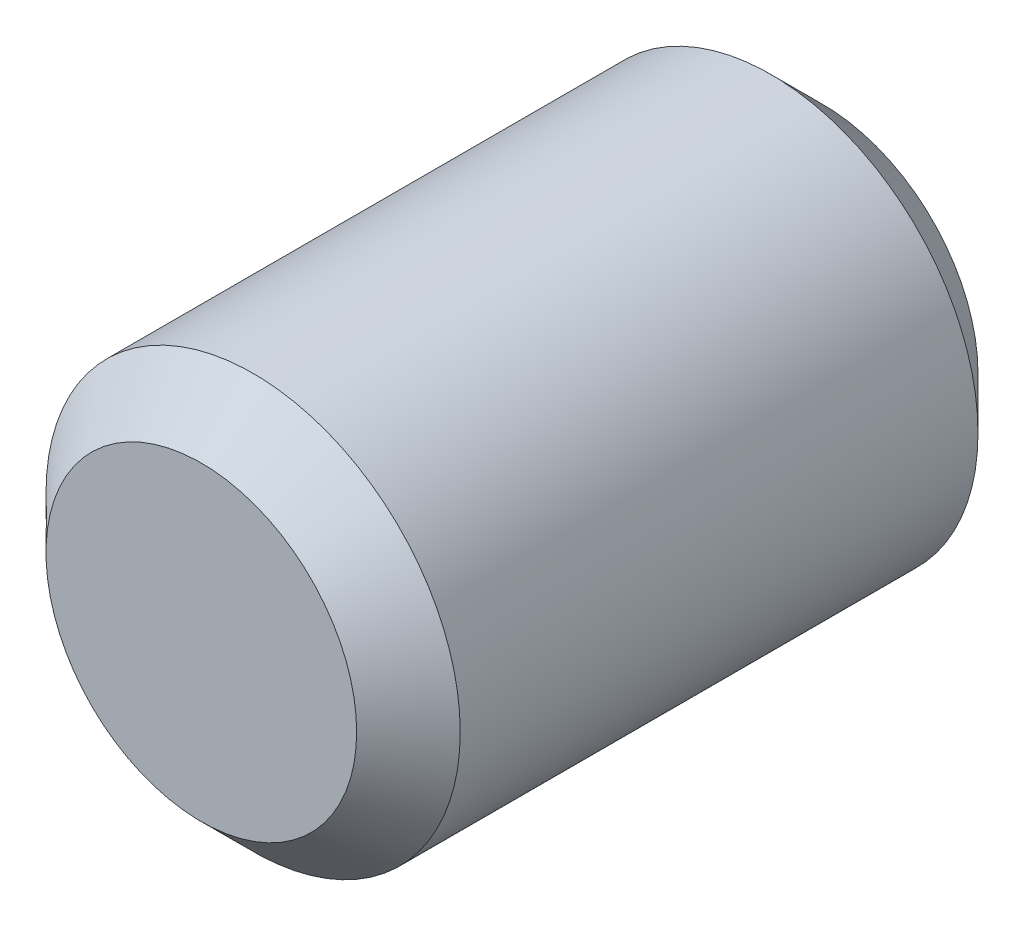
from build123d import *

# Parameters (mm, degrees)
SKETCH1_R           = 2
BOSS_EXTRUDE1_DEPTH = 6
CHAMFER2_SIZE       = 0.5


with BuildPart() as part:
    # Sketch1 → Boss-Extrude1 (new body)
    with BuildSketch(Plane.XY):
        Circle(SKETCH1_R)
    extrude(amount=BOSS_EXTRUDE1_DEPTH)

    # Chamfer2
    chamfer2_edges = [part.edges().sort_by_distance(p)[0] for p in [
        (-2, 0, 0),
        (-2, 0, 6),
    ]]
    chamfer(chamfer2_edges, length=CHAMFER2_SIZE)


solid = part.part
